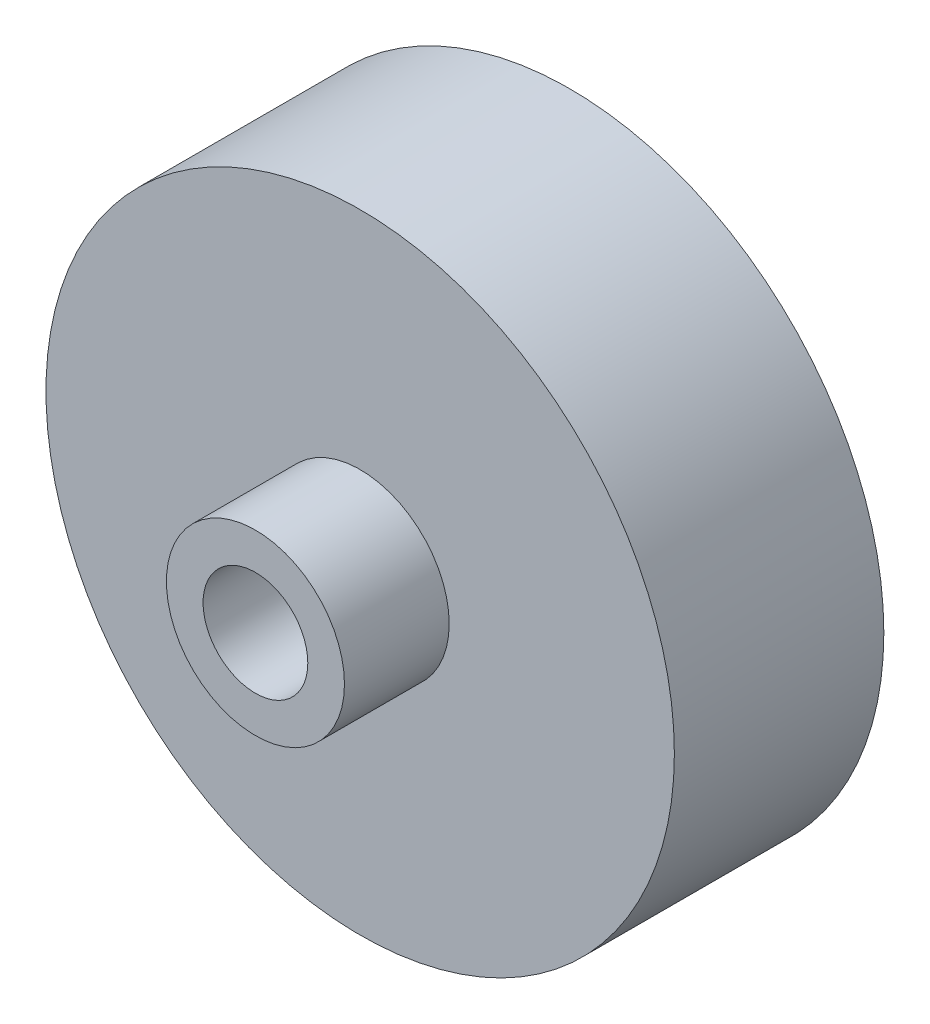
from build123d import *

# Parameters (mm, degrees)
SKETCH1_R          = 30
SKETCH1_R_2        = 5
PULLEYBODY_DEPTH   = 20
SKETCH2_R          = 8.5
SKETCH2_R_2        = 5
CONECTORSTUB_DEPTH = 10


with BuildPart() as part:
    # Sketch1 → PulleyBody (new body)
    with BuildSketch(Plane.XY):
        Circle(SKETCH1_R)
        Circle(SKETCH1_R_2, mode=Mode.SUBTRACT)
    extrude(amount=PULLEYBODY_DEPTH)

    # Sketch2 → ConectorStub (add)
    with BuildSketch(Plane.XY.offset(20)):
        Circle(SKETCH2_R)
        Circle(SKETCH2_R_2, mode=Mode.SUBTRACT)
    extrude(amount=CONECTORSTUB_DEPTH)


solid = part.part
